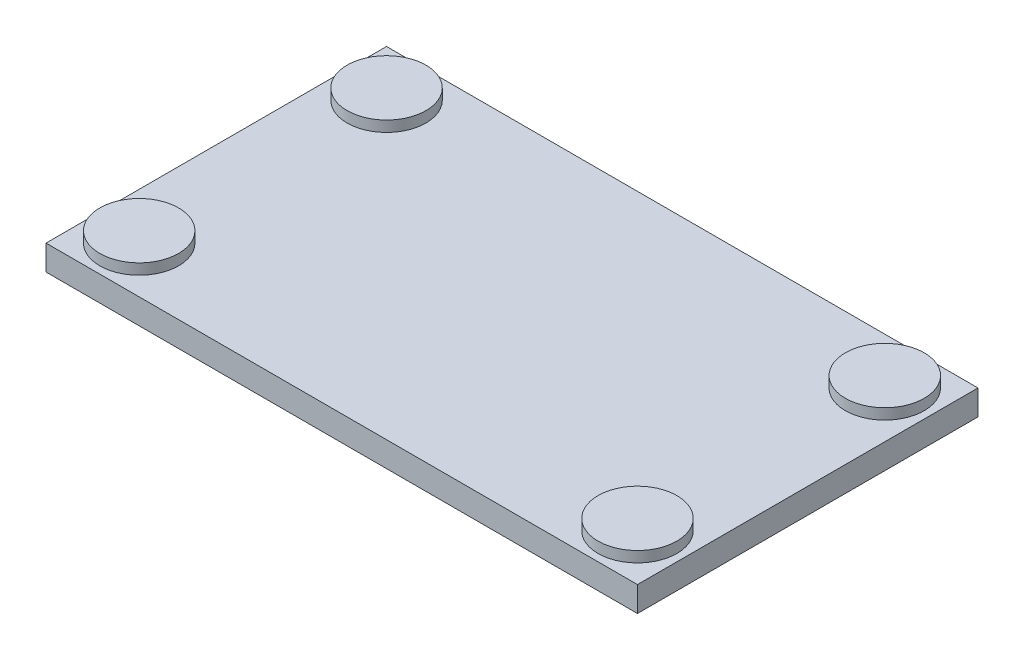
from build123d import *

# Parameters (mm, degrees)
SKETCH_1_W      = 165
SKETCH_1_H      = 95
EXTRUDE_1_DEPTH = 7
SKETCH_2_R      = 11
EXTRUDE_2_DEPTH = 3


with BuildPart() as part:
    # 草图1 → 凸台-拉伸1 (new body)
    with BuildSketch(Plane(origin=(0, 0, 0), x_dir=(1, 0, 0), z_dir=(0, 1, 0))):
        Rectangle(SKETCH_1_W, SKETCH_1_H)
    extrude(amount=EXTRUDE_1_DEPTH)

    # 草图2 → 凸台-拉伸2 (add)
    with BuildSketch(Plane(origin=(0, 7, 0), x_dir=(1, 0, 0), z_dir=(0, 1, 0))):
        with Locations(Location((-69.5, 34.5, 0), (0, 0, 270))):
            Circle(SKETCH_2_R)
        with Locations(Location((-69.5, -34.5, 0), (0, 0, 270))):
            Circle(SKETCH_2_R)
        with Locations(Location((69.5, 34.5, 0), (0, 0, 270))):
            Circle(SKETCH_2_R)
        with Locations(Location((69.5, -34.5, 0), (0, 0, 270))):
            Circle(SKETCH_2_R)
    extrude(amount=EXTRUDE_2_DEPTH)


solid = part.part
